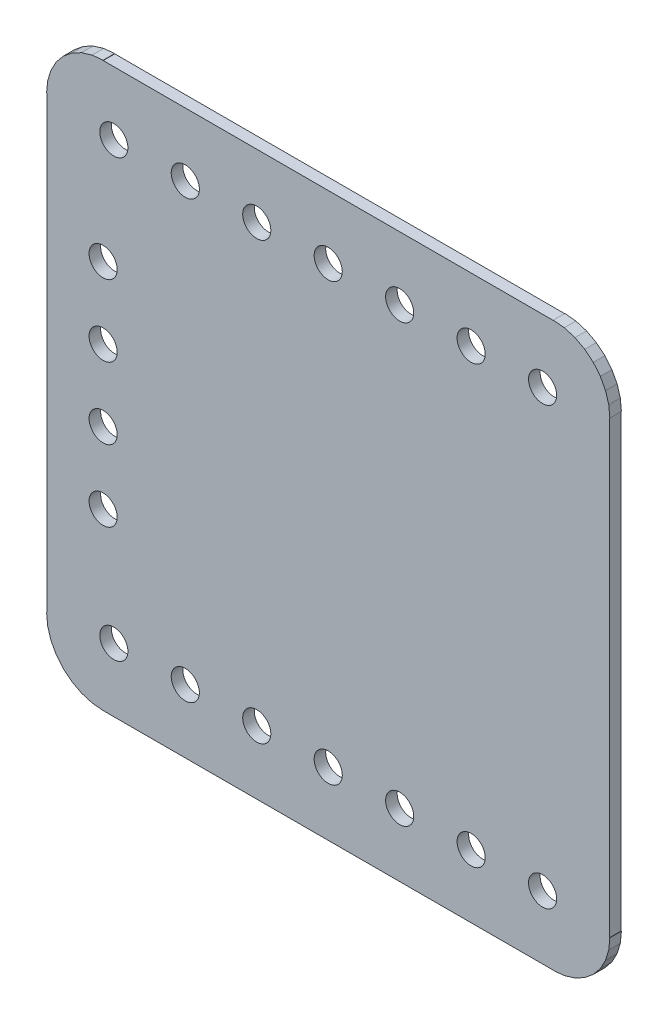
from build123d import *

# Parameters (mm, degrees)
SKETCH_1_R      = 0.499999
EXTRUDE_1_DEPTH = 0.41148


with BuildPart() as part:
    # 草图1 → 凸台-拉伸1 (new body)
    with BuildSketch(Plane(origin=(0, 0, 0), x_dir=(-1, 0, 0), z_dir=(0, 0, -1))):
        Polygon((-4.14330134, 3.23095112), (-4.02893784, 3.60795316), (-3.99032476, 3.99999962), (-4.00003264, 3.99999962), (-4.00003264, 20.00000064), (-3.99032222, 20.00000064), (-4.02893784, 20.39206742), (-4.1432988, 20.76906946), (-4.32901344, 21.11651606), (-4.57894436, 21.42105444), (-4.88348274, 21.67098536), (-5.23092934, 21.8567), (-5.60793138, 21.97106096), (-6.0000007, 22.00967658), (-6.0000007, 21.99997632), (-22.00000172, 21.99997632), (-22.00000172, 22.00967404), (-22.39207104, 21.97105842), (-22.76907054, 21.85669746), (-23.11651714, 21.67098282), (-23.42105806, 21.42105444), (-23.67098644, 21.11651352), (-23.85670108, 20.76906692), (-23.97106204, 20.39206742), (-24.00967766, 20.00000064), (-23.99999264, 20.00000064), (-23.99999264, 3.99999962), (-24.00967512, 3.99999962), (-23.9710595, 3.6079303), (-23.85669854, 3.2309308), (-23.6709839, 2.8834842), (-23.42105552, 2.57894328), (-23.1165146, 2.3290149), (-22.769068, 2.14330026), (-22.3920685, 2.0289393), (-22.00000172, 1.99032368), (-22.00000172, 2.00001632), (-5.999983914, 1.990341433), (-5.60793646, 2.02895454), (-5.23093442, 2.14331804), (-4.88348528, 2.32903268), (-4.57894436, 2.57896106), (-4.32901598, 2.88350198), align=None)
        with Locations(Location((-19.08001264, 19.74999352, 0), (0, 0, 180))):
            Circle(SKETCH_1_R, mode=Mode.SUBTRACT)
        with Locations(Location((-16.54001264, 19.74999352, 0), (0, 0, 180))):
            Circle(SKETCH_1_R, mode=Mode.SUBTRACT)
        with Locations(Location((-21.62001264, 19.74999352, 0), (0, 0, 180))):
            Circle(SKETCH_1_R, mode=Mode.SUBTRACT)
        with Locations(Location((-11.46001264, 19.74999352, 0), (0, 0, 180))):
            Circle(SKETCH_1_R, mode=Mode.SUBTRACT)
        with Locations(Location((-14.00001264, 19.74999352, 0), (0, 0, 180))):
            Circle(SKETCH_1_R, mode=Mode.SUBTRACT)
        with Locations(Location((-19.08001264, 4.24999912, 0), (0, 0, 180))):
            Circle(SKETCH_1_R, mode=Mode.SUBTRACT)
        with Locations(Location((-21.62001264, 4.24999912, 0), (0, 0, 180))):
            Circle(SKETCH_1_R, mode=Mode.SUBTRACT)
        with Locations(Location((-14.00001264, 4.24999912, 0), (0, 0, 180))):
            Circle(SKETCH_1_R, mode=Mode.SUBTRACT)
        with Locations(Location((-16.54001264, 4.24999912, 0), (0, 0, 180))):
            Circle(SKETCH_1_R, mode=Mode.SUBTRACT)
        with Locations(Location((-8.92001264, 19.74999352, 0), (0, 0, 180))):
            Circle(SKETCH_1_R, mode=Mode.SUBTRACT)
        with Locations(Location((-6.38001264, 19.74999352, 0), (0, 0, 180))):
            Circle(SKETCH_1_R, mode=Mode.SUBTRACT)
        with Locations(Location((-6.00002864, 15.80999632, 0), (0, 0, 180))):
            Circle(SKETCH_1_R, mode=Mode.SUBTRACT)
        with Locations(Location((-6.00002864, 13.26999632, 0), (0, 0, 180))):
            Circle(SKETCH_1_R, mode=Mode.SUBTRACT)
        with Locations(Location((-6.00002864, 10.72999632, 0), (0, 0, 180))):
            Circle(SKETCH_1_R, mode=Mode.SUBTRACT)
        with Locations(Location((-8.92001264, 4.24999912, 0), (0, 0, 180))):
            Circle(SKETCH_1_R, mode=Mode.SUBTRACT)
        with Locations(Location((-11.46001264, 4.24999912, 0), (0, 0, 180))):
            Circle(SKETCH_1_R, mode=Mode.SUBTRACT)
        with Locations(Location((-6.00002864, 8.18999632, 0), (0, 0, 180))):
            Circle(SKETCH_1_R, mode=Mode.SUBTRACT)
        with Locations(Location((-6.38001264, 4.24999912, 0), (0, 0, 180))):
            Circle(SKETCH_1_R, mode=Mode.SUBTRACT)
    extrude(amount=-EXTRUDE_1_DEPTH)


solid = part.part
